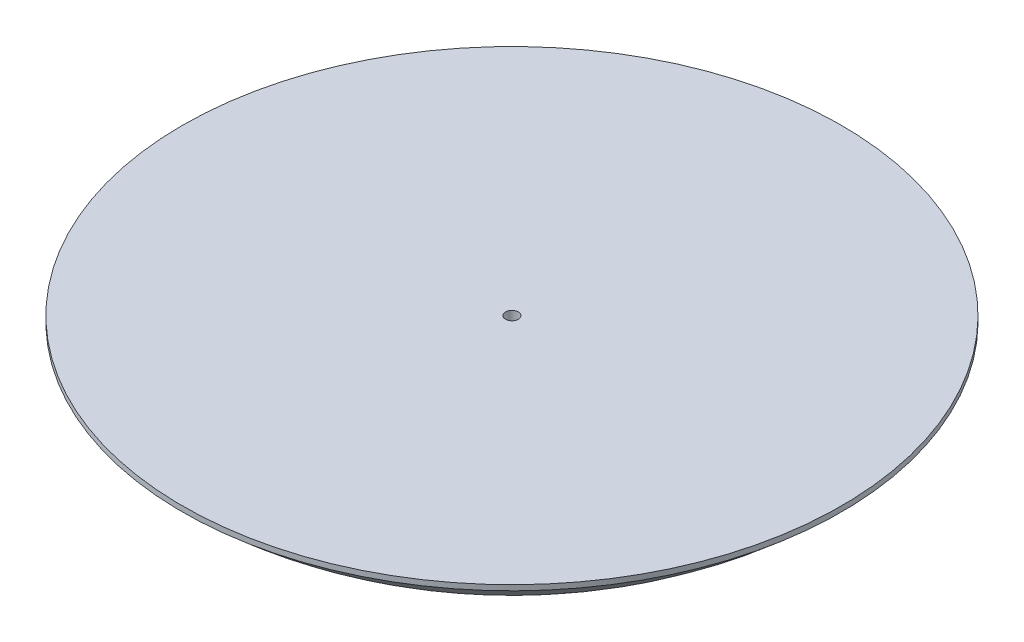
from build123d import *

# Parameters (mm, degrees)
SKETCH5_R          = 1.2
CUT_EXTRUDE1_DEPTH = 95.467954306


with BuildPart() as part:
    # Sketch3 → Revolve4 (revolve)
    with BuildSketch(Plane.XY, mode=Mode.PRIVATE) as revolve4_sk:
        with BuildLine():
            Line((1.2, 35.159555727), (1.2, 30.159555727))
            Line((1.2, 30.159555727), (0, 30.159555727))
            Line((0, 30.159555727), (0, 0))
            add(Edge.make_bspline(
                [(0, 0), (3.750000005, 0.294761526), (7.499999999, 5.048271343), (11.250000002, 6.10210111), (14.999999999, 9.433669628), (18.749999999, 11.703227443), (22.499999999, 13.953126222), (26.249999999, 16.181221128), (30, 18.316968407)],
                knots=[0.079130383, 0.079130383, 0.079130383, 0.079130383, 0.079130383, 0.079130383, 0.079130383, 0.079130383, 0.079130383, 0.916284581, 0.916284581, 0.916284581, 0.916284581, 0.916284581, 0.916284581, 0.916284581, 0.916284581, 0.916284581], degree=8))
            Line((30, 18.316968407), (30, 19.316968407))
            Line((30, 19.316968407), (32, 19.316968407))
            add(Edge.make_bspline(
                [(32, 19.316968407), (47, 20.496014481), (62, 34.159555727)],
                knots=[0.08454747, 0.08454747, 0.08454747, 0.930022175, 0.930022175, 0.930022175], degree=2))
            Line((62, 34.159555727), (62, 35.159555727))
            Line((62, 35.159555727), (1.2, 35.159555727))
        make_face()
    revolve(revolve4_sk.sketch.rotate(Axis((0, 35.159555727, 0), (0, -1, 0)), 180), axis=Axis((0, 35.159555727, 0), (0, -1, 0)))

    # Sketch5 → Cut-Extrude1 (cut, through all)
    with BuildSketch(Plane(origin=(0, 35.159555727, 0), x_dir=(1, 0, 0), z_dir=(0, 1, 0))):
        with Locations(Location((0, 0, 0), (0, 0, 180))):
            Circle(SKETCH5_R)
    extrude(amount=-CUT_EXTRUDE1_DEPTH, mode=Mode.SUBTRACT)


solid = part.part
